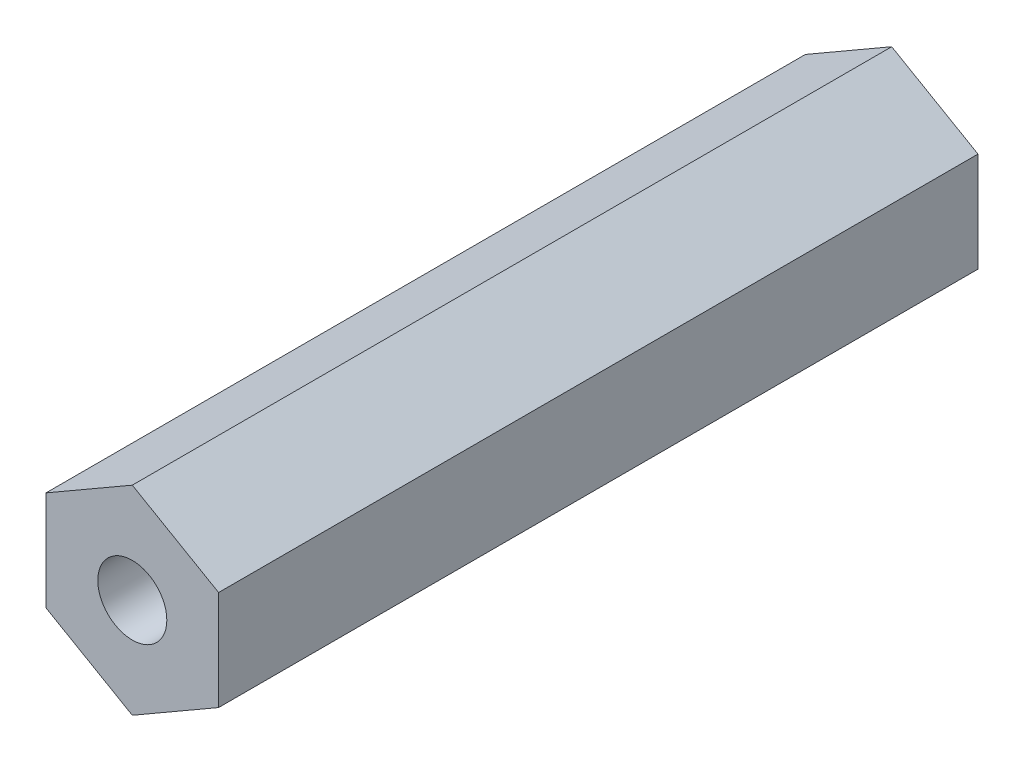
from build123d import *

# Parameters (mm, degrees)
SKETCH1_R           = 1
BOSS_EXTRUDE1_DEPTH = 22


with BuildPart() as part:
    # Sketch1 → Boss-Extrude1 (new body)
    with BuildSketch(Plane.XY):
        Polygon((0, 2.886751346), (-2.5, 1.443375673), (-2.5, -1.443375673), (0, -2.886751346), (2.5, -1.443375673), (2.5, 1.443375673), align=None)
        Circle(SKETCH1_R, mode=Mode.SUBTRACT)
    extrude(amount=BOSS_EXTRUDE1_DEPTH)


solid = part.part
